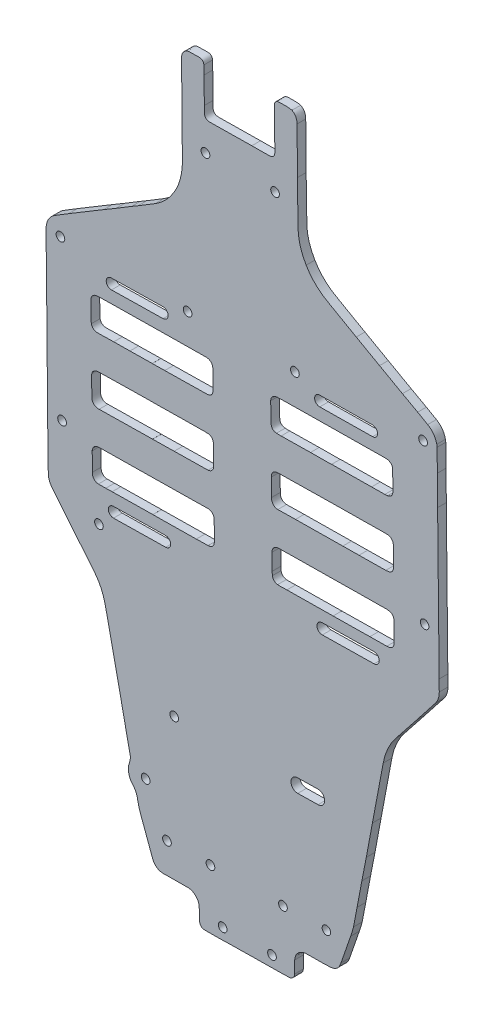
from build123d import *

# Parameters (mm, degrees)
MODEL_R             = 1.5
MODEL_R_2           = 1.468482627
MODEL_R_3           = 1.475701342
MODEL_R_4           = 1.507157975
BOSS_EXTRUDE1_DEPTH = 3


with BuildPart() as part:
    # Model → Boss-Extrude1 (new body)
    with BuildSketch(Plane.XY):
        with BuildLine():
            add(Edge.make_bspline(
                [(160.171925823, 234.723381136), (157.571158998, 236.19530425), (154.962787954, 237.654358503), (152.380608071, 239.158239547), (151.115466493, 239.89506832), (149.810857366, 240.560909295), (148.600443434, 241.399863038), (146.242257389, 243.034347797), (144.364707567, 245.080605145), (142.900254867, 247.544344253)],
                knots=[127, 127, 127, 127, 128, 128, 128, 129, 129, 129, 130, 130, 130, 130], degree=3))
            add(Edge.make_bspline(
                [(142.900254867, 247.544344253), (141.068991595, 250.625158939), (140.146608115, 253.947469964), (140.092159428, 257.51448809), (140.017305399, 262.418383717), (139.967568022, 267.322666494), (139.90706489, 272.226781506)],
                knots=[130, 130, 130, 130, 131, 131, 131, 132, 132, 132, 132], degree=3))
            add(Edge.make_bspline(
                [(139.90706489, 272.226781506), (139.912871372, 272.226853774), (139.918677854, 272.226926042), (139.924484337, 272.226995729)],
                knots=[0, 0, 0, 0, 1, 1, 1, 1], degree=3))
            add(Edge.make_bspline(
                [(139.924484337, 272.226995729), (139.888384961, 275.806403941), (139.852709189, 279.385814735), (139.815989904, 282.965216495), (139.798353489, 284.684448357), (139.787918352, 286.403843468), (139.753399745, 288.122746899)],
                knots=[1, 1, 1, 1, 2, 2, 2, 3, 3, 3, 3], degree=3))
            add(Edge.make_bspline(
                [(139.753399745, 288.122746899), (139.744979312, 288.541747576), (139.709458518, 288.975462529), (139.590559944, 289.373851348), (139.332853381, 290.237338778), (138.881704169, 290.98874955), (137.979312759, 291.313631516)],
                knots=[3, 3, 3, 3, 4, 4, 4, 5, 5, 5, 5], degree=3))
            add(Edge.make_bspline(
                [(137.979312759, 291.313631516), (137.587571507, 291.454658918), (137.157209915, 291.535657766), (136.74085827, 291.551576078), (135.83971701, 291.586027898), (134.936230427, 291.56772313), (134.033880344, 291.556125734), (133.753547097, 291.552522659), (133.4687815, 291.524875642), (133.194822985, 291.466839943), (132.495834097, 291.318765769), (132.113949401, 290.926184198), (132.019309938, 290.206882989)],
                knots=[5, 5, 5, 5, 6, 6, 6, 7, 7, 7, 8, 8, 8, 9, 9, 9, 9], degree=3))
            add(Edge.make_bspline(
                [(132.019309938, 290.206882989), (131.960904165, 289.762879529), (131.97053342, 289.308194604), (131.973085379, 288.858436806), (131.975482361, 288.436122771), (132.022450811, 288.014096517), (132.025942966, 287.591745703)],
                knots=[9, 9, 9, 9, 10, 10, 10, 11, 11, 11, 11], degree=3))
            add(Edge.make_bspline(
                [(132.025942966, 287.591745703), (132.03942599, 285.957408707), (132.04113074, 284.322978149), (132.051441895, 282.688609535)],
                knots=[11, 11, 11, 11, 12, 12, 12, 12], degree=3))
            add(Edge.make_bspline(
                [(132.051441895, 282.688609535), (132.064790605, 280.575224273), (132.082509675, 278.461867402), (132.097325504, 276.348489883), (132.099102577, 276.094855105), (132.106975423, 275.84037376), (132.090702808, 275.587655238)],
                knots=[12, 12, 12, 12, 13, 13, 13, 14, 14, 14, 14], degree=3))
            add(Edge.make_bspline(
                [(132.090702808, 275.587655238), (132.028422602, 274.620712332), (131.478604518, 274.038255694), (130.512517444, 273.908493385), (130.373234191, 273.889783723), (130.231502297, 273.884188117), (130.090762257, 273.882211072), (128.624573812, 273.861581147), (127.158375035, 273.840383401), (125.692124599, 273.825129697), (125.184542991, 273.819848973), (124.676641097, 273.84048406), (124.169162807, 273.832477801)],
                knots=[14, 14, 14, 14, 15, 15, 15, 16, 16, 16, 17, 17, 17, 18, 18, 18, 18], degree=3))
            add(Edge.make_bspline(
                [(124.169162807, 273.832477801), (121.970004121, 273.797802079), (119.770969417, 273.754936846), (117.571821063, 273.719832678), (117.09254864, 273.712182597), (116.61284228, 273.732451183), (116.133538861, 273.725709613), (114.01897711, 273.695973923), (111.904580667, 273.644490735), (109.789956925, 273.634226102), (108.519163842, 273.628054933), (107.846324788, 274.298890141), (107.810421717, 275.547292284), (107.790171351, 276.251441737), (107.805038839, 276.956529384), (107.797372629, 277.661121478)],
                knots=[18, 18, 18, 18, 19, 19, 19, 20, 20, 20, 21, 21, 21, 22, 22, 22, 23, 23, 23, 23], degree=3))
            add(Edge.make_bspline(
                [(107.797372629, 277.661121478), (107.764527777, 280.675856136), (107.732199515, 283.690601118), (107.693062584, 286.70525641)],
                knots=[23, 23, 23, 23, 24, 24, 24, 24], degree=3))
            add(Edge.make_bspline(
                [(107.693062584, 286.70525641), (107.68026146, 287.691583264), (107.666272177, 288.678568272), (107.618322205, 289.66357559)],
                knots=[24, 24, 24, 24, 25, 25, 25, 25], degree=3))
            add(Edge.make_bspline(
                [(107.618322205, 289.66357559), (107.57018626, 290.651982084), (106.946485337, 291.210315414), (105.97186418, 291.188498875), (104.929280317, 291.165162126), (103.88588024, 291.101826345), (102.844401882, 291.125252138), (101.553813034, 291.154280634), (100.013318146, 290.056831447), (99.967124583, 288.368394775)],
                knots=[25, 25, 25, 25, 26, 26, 26, 27, 27, 27, 28, 28, 28, 28], degree=3))
            add(Edge.make_bspline(
                [(99.967124583, 288.368394775), (99.933236216, 287.129297133), (99.947938394, 285.88867154), (99.953135299, 284.64877766)],
                knots=[28, 28, 28, 28, 29, 29, 29, 29], degree=3))
            add(Edge.make_bspline(
                [(99.953135299, 284.64877766), (99.956668782, 283.803899233), (99.98267397, 282.959130499), (99.99561974, 282.114266268)],
                knots=[29, 29, 29, 29, 30, 30, 30, 30], degree=3))
            add(Edge.make_bspline(
                [(99.99561974, 282.114266268), (100.001674186, 281.71991026), (99.997789422, 281.325405844), (100.00334794, 280.931038222)],
                knots=[30, 30, 30, 30, 31, 31, 31, 31], degree=3))
            add(Edge.make_bspline(
                [(100.00334794, 280.931038222), (100.015270859, 280.085872014), (100.036647393, 279.240796141), (100.042949803, 278.395600251)],
                knots=[31, 31, 31, 31, 32, 32, 32, 32], degree=3))
            add(Edge.make_bspline(
                [(100.042949803, 278.395600251), (100.056618799, 276.563853606), (100.064295341, 274.732059212), (100.072426483, 272.900272562), (100.078181306, 271.603942557), (100.072529801, 270.307509311), (100.086415766, 269.011277384)],
                knots=[32, 32, 32, 32, 33, 33, 33, 34, 34, 34, 34], degree=3))
            add(Edge.make_bspline(
                [(100.086415766, 269.011277384), (100.108432872, 266.954667649), (100.142310907, 264.898184382), (100.171591282, 262.841654658)],
                knots=[34, 34, 34, 34, 35, 35, 35, 35], degree=3))
            add(Edge.make_bspline(
                [(100.171591282, 262.841654658), (100.182016088, 262.109097438), (100.198485007, 261.376589258), (100.20378523, 260.644001067)],
                knots=[35, 35, 35, 35, 36, 36, 36, 36], degree=3))
            add(Edge.make_bspline(
                [(100.20378523, 260.644001067), (100.21440634, 259.17845302), (100.273070409, 257.710752421), (100.215615163, 256.247713105)],
                knots=[36, 36, 36, 36, 37, 37, 37, 37], degree=3))
            add(Edge.make_bspline(
                [(100.215615163, 256.247713105), (100.081673461, 252.837787486), (99.167700081, 249.642562274), (97.433979513, 246.689181835)],
                knots=[37, 37, 37, 37, 38, 38, 38, 38], degree=3))
            add(Edge.make_bspline(
                [(97.433979513, 246.689181835), (95.790269752, 243.889123064), (93.604284136, 241.612145049), (90.849149601, 239.89592005)],
                knots=[38, 38, 38, 38, 39, 39, 39, 39], degree=3))
            add(Edge.make_bspline(
                [(90.849149601, 239.89592005), (88.887168154, 238.673760214), (86.90010105, 237.491745238), (84.920849967, 236.297393087)],
                knots=[39, 39, 39, 39, 40, 40, 40, 40], degree=3))
            add(Edge.make_bspline(
                [(84.920849967, 236.297393087), (84.196739261, 235.860429946), (83.458205336, 235.447299751), (82.734456243, 235.009748143)],
                knots=[40, 40, 40, 40, 41, 41, 41, 41], degree=3))
            add(Edge.make_bspline(
                [(82.734456243, 235.009748143), (80.949526014, 233.930668572), (79.17419921, 232.835659074), (77.385730332, 231.762500314)],
                knots=[41, 41, 41, 41, 42, 42, 42, 42], degree=3))
            add(Edge.make_bspline(
                [(77.385730332, 231.762500314), (75.959489865, 230.906677161), (74.513949561, 230.08297196), (73.08714601, 229.228072804)],
                knots=[42, 42, 42, 42, 43, 43, 43, 43], degree=3))
            add(Edge.make_bspline(
                [(73.08714601, 229.228072804), (71.370545265, 228.199524032), (69.669411254, 227.145237537), (67.953079137, 226.116249995), (65.632268448, 224.724864376), (63.300929634, 223.35102955), (60.978832633, 221.961791321)],
                knots=[43, 43, 43, 43, 44, 44, 44, 45, 45, 45, 45], degree=3))
            add(Edge.make_bspline(
                [(60.978832633, 221.961791321), (59.503025264, 221.078867678), (58.037813176, 220.178295163), (56.56423748, 219.291634233), (54.316772374, 217.939319777), (53.209139378, 215.942245947), (53.21687791, 213.334698734), (53.222901361, 211.305517276), (53.273961211, 209.276511325), (53.294511199, 207.247329867), (53.323626265, 204.372561497), (53.337377916, 201.497638268), (53.36801176, 198.622890546), (53.414267314, 194.282372812), (53.474775612, 189.941999615), (53.519393573, 185.601471557)],
                knots=[45, 45, 45, 45, 46, 46, 46, 47, 47, 47, 48, 48, 48, 49, 49, 49, 50, 50, 50, 50], degree=3))
            add(Edge.make_bspline(
                [(53.519393573, 185.601471557), (53.571543429, 180.528714066), (53.61380057, 175.45586366), (53.658981614, 170.383033902), (53.682078396, 167.790089982), (53.700939132, 165.197104765), (53.724149563, 162.604160845)],
                knots=[50, 50, 50, 50, 51, 51, 51, 52, 52, 52, 52], degree=3))
            add(Edge.make_bspline(
                [(53.724149563, 162.604160845), (53.741047253, 160.716046471), (53.762279141, 158.827973393), (53.780948739, 156.939879667), (53.79822354, 155.192842701), (53.813519798, 153.445805735), (53.831750293, 151.698779094), (53.85439764, 149.528871243), (53.873418519, 147.358901448), (53.905013222, 145.189117485), (53.926756535, 143.695937262), (53.971250514, 142.203097732), (53.997896276, 140.709979454), (54.016049282, 139.692807725), (54.355945466, 138.776129776), (54.872619074, 137.920662801)],
                knots=[52, 52, 52, 52, 53, 53, 53, 54, 54, 54, 55, 55, 55, 56, 56, 56, 57, 57, 57, 57], degree=3))
            add(Edge.make_bspline(
                [(54.872619074, 137.920662801), (55.104800878, 137.536228153), (55.372694615, 137.169199763), (55.657238078, 136.821074611), (58.493864836, 133.350642631), (61.335967457, 129.884670617), (64.17969734, 126.420040724)],
                knots=[57, 57, 57, 57, 58, 58, 58, 59, 59, 59, 59], degree=3))
            add(Edge.make_bspline(
                [(64.17969734, 126.420040724), (65.163136705, 125.221868693), (66.158643634, 124.033597376), (67.142873383, 122.836065433)],
                knots=[59, 59, 59, 59, 60, 60, 60, 60], degree=3))
            add(Edge.make_bspline(
                [(67.142873383, 122.836065433), (68.127211616, 121.638440575), (69.127791469, 120.453101272), (70.079641297, 119.230058735)],
                knots=[60, 60, 60, 60, 61, 61, 61, 61], degree=3))
            add(Edge.make_bspline(
                [(70.079641297, 119.230058735), (71.912717803, 116.874680292), (73.051351422, 114.194839295), (73.678751136, 111.29034814), (74.255700577, 108.619427077), (74.820969896, 105.945966309), (75.392154182, 103.273785718), (76.122159191, 99.858607766), (76.856126452, 96.444235086), (77.582458499, 93.028251862)],
                knots=[61, 61, 61, 61, 62, 62, 62, 63, 63, 63, 64, 64, 64, 64], degree=3))
            add(Edge.make_bspline(
                [(77.582458499, 93.028251862), (78.25616026, 89.85981742), (78.926653991, 86.690680946), (79.590075591, 83.520078465)],
                knots=[64, 64, 64, 64, 65, 65, 65, 65], degree=3))
            add(Edge.make_bspline(
                [(79.590075591, 83.520078465), (80.207381118, 80.569831359), (80.811074472, 77.61673483), (81.425760882, 74.665930228)],
                knots=[65, 65, 65, 65, 66, 66, 66, 66], degree=3))
            add(Edge.make_bspline(
                [(81.425760882, 74.665930228), (81.666983028, 73.507970163), (81.907001517, 72.349370011), (82.175525495, 71.197583696)],
                knots=[66, 66, 66, 66, 67, 67, 67, 67], degree=3))
            add(Edge.make_bspline(
                [(82.175525495, 71.197583696), (82.360888661, 70.402470802), (82.291381348, 69.63141282), (82.070905495, 68.860932982)],
                knots=[67, 67, 67, 67, 68, 68, 68, 68], degree=3))
            add(Edge.make_bspline(
                [(82.070905495, 68.860932982), (81.962374902, 68.48162936), (81.838227764, 68.106001081), (81.749529097, 67.722154902), (81.680238752, 67.422284107), (81.626446136, 67.113452084), (81.614445728, 66.806705508)],
                knots=[68, 68, 68, 68, 69, 69, 69, 70, 70, 70, 70], degree=3))
            add(Edge.make_bspline(
                [(81.614445728, 66.806705508), (81.548549386, 65.12176738), (82.077714164, 63.644073152), (83.21962297, 62.399391519)],
                knots=[70, 70, 70, 70, 71, 71, 71, 71], degree=3))
            add(Edge.make_bspline(
                [(83.21962297, 62.399391519), (83.963839395, 61.588173191), (84.437703112, 60.647161583), (84.661355999, 59.574808095)],
                knots=[71, 71, 71, 71, 72, 72, 72, 72], degree=3))
            add(Edge.make_bspline(
                [(84.661355999, 59.574808095), (84.730388048, 59.24377948), (84.799399434, 58.912750865), (84.865476583, 58.581123458), (85.119107243, 57.308154075), (85.443676174, 56.055151301), (85.906696646, 54.840285369)],
                knots=[72, 72, 72, 72, 73, 73, 73, 74, 74, 74, 74], degree=3))
            add(Edge.make_bspline(
                [(85.906696646, 54.840285369), (86.277965398, 53.866133733), (86.651155869, 52.892684129), (87.013430773, 51.915187518)],
                knots=[74, 74, 74, 74, 75, 75, 75, 75], degree=3))
            add(Edge.make_bspline(
                [(87.013430773, 51.915187518), (87.493106138, 50.620950703), (87.961447497, 49.322563642), (88.437465397, 48.026964059)],
                knots=[75, 75, 75, 75, 76, 76, 76, 76], degree=3))
            add(Edge.make_bspline(
                [(88.437465397, 48.026964059), (88.952423923, 46.625419627), (89.473560878, 45.226105179), (89.986639013, 43.823858715)],
                knots=[76, 76, 76, 76, 77, 77, 77, 77], degree=3))
            add(Edge.make_bspline(
                [(89.986639013, 43.823858715), (90.577484751, 42.209103113), (92.069657721, 41.201109417), (93.772517146, 41.270734448)],
                knots=[77, 77, 77, 77, 78, 78, 78, 78], degree=3))
            add(Edge.make_bspline(
                [(93.772517146, 41.270734448), (94.110636257, 41.284547955), (94.449158309, 41.292683264), (94.787546047, 41.294789359), (97.184600396, 41.30969721), (99.581654745, 41.326422084), (101.978729757, 41.331129826), (102.314286577, 41.331790562), (102.661353043, 41.313661624), (102.983664471, 41.229748183)],
                knots=[78, 78, 78, 78, 79, 79, 79, 80, 80, 80, 81, 81, 81, 81], degree=3))
            add(Edge.make_bspline(
                [(102.983664471, 41.229748183), (104.672172999, 40.790214368), (105.888000805, 39.31580317), (106.024391148, 37.574454727), (106.039775227, 37.378009726), (106.036572363, 37.180098719), (106.041572964, 36.982869095)],
                knots=[81, 81, 81, 81, 82, 82, 82, 83, 83, 83, 83], degree=3))
            add(Edge.make_bspline(
                [(106.041572964, 36.982869095), (106.072330789, 35.771410082), (106.093170068, 34.559538108), (106.141099377, 33.348760479)],
                knots=[83, 83, 83, 83, 84, 84, 84, 84], degree=3))
            add(Edge.make_bspline(
                [(106.141099377, 33.348760479), (106.151937455, 33.075257171), (106.214827238, 32.786618884), (106.326514202, 32.537521503), (106.652131812, 31.811290313), (107.266854383, 31.52261073), (108.034115932, 31.522879154)],
                knots=[84, 84, 84, 84, 85, 85, 85, 86, 86, 86, 86], degree=3))
            add(Edge.make_bspline(
                [(108.034115932, 31.522879154), (109.359708983, 31.523312762), (110.685508671, 31.518563724), (112.010833095, 31.54009958)],
                knots=[86, 86, 86, 86, 87, 87, 87, 87], degree=3))
            add(Edge.make_bspline(
                [(112.010833095, 31.54009958), (113.786862462, 31.568944825), (115.562313248, 31.63697996), (117.338373611, 31.658825536)],
                knots=[87, 87, 87, 87, 88, 88, 88, 88], degree=3))
            add(Edge.make_bspline(
                [(117.338373611, 31.658825536), (119.96051697, 31.691057053), (122.583724506, 31.645218509), (125.20435942, 31.780504156)],
                knots=[88, 88, 88, 88, 89, 89, 89, 89], degree=3))
            add(Edge.make_bspline(
                [(125.20435942, 31.780504156), (125.654837063, 31.803774444), (126.106172248, 31.817319527), (126.557238805, 31.821056813), (128.954003863, 31.840920182), (131.350903234, 31.847857907), (133.747533979, 31.877012873)],
                knots=[89, 89, 89, 89, 90, 90, 90, 91, 91, 91, 91], degree=3))
            add(Edge.make_bspline(
                [(133.747533979, 31.877012873), (134.81794143, 31.890021108), (135.887718641, 31.948702703), (136.958022775, 31.977878316)],
                knots=[91, 91, 91, 91, 92, 92, 92, 92], degree=3))
            add(Edge.make_bspline(
                [(136.958022775, 31.977878316), (137.331631685, 31.988057776), (137.679225074, 32.050559249), (138.00311727, 32.25749343)],
                knots=[92, 92, 92, 92, 93, 93, 93, 93], degree=3))
            add(Edge.make_bspline(
                [(138.00311727, 32.25749343), (138.602776049, 32.640575634), (138.88494836, 33.199475493), (138.911935072, 33.885463747)],
                knots=[93, 93, 93, 93, 94, 94, 94, 94], degree=3))
            add(Edge.make_bspline(
                [(138.911935072, 33.885463747), (138.941814692, 34.645289221), (138.937000065, 35.406560055), (138.94112246, 36.167232097), (138.944635279, 36.815289988), (138.899495561, 37.46632119), (138.946660316, 38.110868923)],
                knots=[94, 94, 94, 94, 95, 95, 95, 96, 96, 96, 96], degree=3))
            add(Edge.make_bspline(
                [(138.946660316, 38.110868923), (139.034966373, 39.31776473), (139.529209602, 40.346716138), (140.504874273, 41.088123603)],
                knots=[96, 96, 96, 96, 97, 97, 97, 97], degree=3))
            add(Edge.make_bspline(
                [(140.504874273, 41.088123603), (141.262485903, 41.663872224), (142.126463609, 41.977060974), (143.098760107, 41.975202655)],
                knots=[97, 97, 97, 97, 98, 98, 98, 98], degree=3))
            add(Edge.make_bspline(
                [(143.098760107, 41.975202655), (144.790967427, 41.971981568), (146.483371051, 41.979931045), (148.175413061, 42.003614292)],
                knots=[98, 98, 98, 98, 99, 99, 99, 99], degree=3))
            add(Edge.make_bspline(
                [(148.175413061, 42.003614292), (149.246698717, 42.018584087), (150.323263933, 42.012843945), (151.387121012, 42.11944953)],
                knots=[99, 99, 99, 99, 100, 100, 100, 100], degree=3))
            add(Edge.make_bspline(
                [(151.387121012, 42.11944953), (153.014671808, 42.282486078), (154.149849433, 43.153975896), (154.727098497, 44.7075102), (154.786000197, 44.866024838), (154.847474521, 45.023672261), (154.902832408, 45.183425778)],
                knots=[100, 100, 100, 100, 101, 101, 101, 102, 102, 102, 102], degree=3))
            add(Edge.make_bspline(
                [(154.902832408, 45.183425778), (156.019206122, 48.404450657), (157.144661506, 51.622419633), (158.245051897, 54.848895582)],
                knots=[102, 102, 102, 102, 103, 103, 103, 103], degree=3))
            add(Edge.make_bspline(
                [(158.245051897, 54.848895582), (158.608638942, 55.914951432), (158.982671457, 56.986953905), (159.219394095, 58.08474572)],
                knots=[103, 103, 103, 103, 104, 104, 104, 104], degree=3))
            add(Edge.make_bspline(
                [(159.219394095, 58.08474572), (159.682507554, 60.232487951), (160.053926118, 62.400010959), (160.460462535, 64.559873561)],
                knots=[104, 104, 104, 104, 105, 105, 105, 105], degree=3))
            add(Edge.make_bspline(
                [(160.460462535, 64.559873561), (161.007800982, 67.467833579), (161.543051201, 70.378085523), (162.101093413, 73.283980741)],
                knots=[105, 105, 105, 105, 106, 106, 106, 106], degree=3))
            add(Edge.make_bspline(
                [(162.101093413, 73.283980741), (162.600698857, 75.885607143), (163.139306917, 78.479758971), (163.633508819, 81.082376475)],
                knots=[106, 106, 106, 106, 107, 107, 107, 107], degree=3))
            add(Edge.make_bspline(
                [(163.633508819, 81.082376475), (164.348439703, 84.847455308), (165.035164722, 88.617861322), (165.74079697, 92.384715881)],
                knots=[107, 107, 107, 107, 108, 108, 108, 108], degree=3))
            add(Edge.make_bspline(
                [(165.74079697, 92.384715881), (166.373786197, 95.76382179), (167.017189898, 99.140945492), (167.653867585, 102.519370018), (168.259301852, 105.731991164), (168.868507232, 108.94388963), (169.464074611, 112.158348447)],
                knots=[108, 108, 108, 108, 109, 109, 109, 110, 110, 110, 110], degree=3))
            add(Edge.make_bspline(
                [(169.464074611, 112.158348447), (170.129578073, 115.750231919), (171.601087405, 118.964897216), (173.888655467, 121.818346533)],
                knots=[110, 110, 110, 110, 111, 111, 111, 111], degree=3))
            add(Edge.make_bspline(
                [(173.888655467, 121.818346533), (176.216393641, 124.721929176), (178.519521423, 127.645323568), (180.822525222, 130.568635368)],
                knots=[111, 111, 111, 111, 112, 112, 112, 112], degree=3))
            add(Edge.make_bspline(
                [(180.822525222, 130.568635368), (183.020371767, 133.358509516), (185.198195247, 136.164158731), (187.396971656, 138.953299875)],
                knots=[112, 112, 112, 112, 113, 113, 113, 113], degree=3))
            add(Edge.make_bspline(
                [(187.396971656, 138.953299875), (188.343738229, 140.154280033), (188.787779149, 141.519184602), (188.79420554, 143.030349226)],
                knots=[113, 113, 113, 113, 114, 114, 114, 114], degree=3))
            add(Edge.make_bspline(
                [(188.79420554, 143.030349226), (188.799743395, 144.326743756), (188.770834966, 145.623282822), (188.755564537, 146.91974962)],
                knots=[114, 114, 114, 114, 115, 115, 115, 115], degree=3))
            add(Edge.make_bspline(
                [(188.755564537, 146.91974962), (188.704153405, 151.288266032), (188.647844991, 155.656741147), (188.601331142, 160.025309179), (188.551221819, 164.731668043), (188.510039189, 169.438109499), (188.464868476, 174.144519983), (188.440258083, 176.708979998), (188.41701149, 179.273450337), (188.390500042, 181.837889704), (188.335431446, 187.164462642), (188.274763005, 192.490983959), (188.223889127, 197.817598193)],
                knots=[115, 115, 115, 115, 116, 116, 116, 117, 117, 117, 118, 118, 118, 119, 119, 119, 119], degree=3))
            add(Edge.make_bspline(
                [(188.223889127, 197.817598193), (188.191343897, 201.226870819), (188.178387796, 204.636349925), (188.145078011, 208.045612227)],
                knots=[119, 119, 119, 119, 120, 120, 120, 120], degree=3))
            add(Edge.make_bspline(
                [(188.145078011, 208.045612227), (188.120033682, 210.609855438), (188.07947096, 213.173974761), (188.03721382, 215.73800633)],
                knots=[120, 120, 120, 120, 121, 121, 121, 121], degree=3))
            add(Edge.make_bspline(
                [(188.03721382, 215.73800633), (188.032626493, 216.017213646), (187.994605398, 216.30086028), (187.932180548, 216.573320865)],
                knots=[121, 121, 121, 121, 122, 122, 122, 122], degree=3))
            add(Edge.make_bspline(
                [(187.932180548, 216.573320865), (187.500951083, 218.454657535), (186.465558166, 219.911265001), (184.803395776, 220.898775888)],
                knots=[122, 122, 122, 122, 123, 123, 123, 123], degree=3))
            add(Edge.make_bspline(
                [(184.803395776, 220.898775888), (183.664478032, 221.575431249), (182.50921535, 222.225177113), (181.351906968, 222.870230721)],
                knots=[123, 123, 123, 123, 124, 124, 124, 124], degree=3))
            add(Edge.make_bspline(
                [(181.351906968, 222.870230721), (179.603907826, 223.844495921), (177.844068419, 224.797467879), (176.096027949, 225.771624677)],
                knots=[124, 124, 124, 124, 125, 125, 125, 125], degree=3))
            add(Edge.make_bspline(
                [(176.096027949, 225.771624677), (173.46110413, 227.240016985), (170.830333702, 228.715847731), (168.200968401, 230.194145913)],
                knots=[125, 125, 125, 125, 126, 126, 126, 126], degree=3))
            add(Edge.make_bspline(
                [(168.200968401, 230.194145913), (165.522454637, 231.700065947), (162.846141551, 233.209878127), (160.171925823, 234.723381136)],
                knots=[126, 126, 126, 126, 127, 127, 127, 127], degree=3))
        make_face()
        with Locations((94.90607237, 51.702259327)):
            Circle(MODEL_R, mode=Mode.SUBTRACT)
        with Locations((114.116887182, 35.46431498)):
            Circle(MODEL_R, mode=Mode.SUBTRACT)
        with Locations((109.904670104, 51.907359304)):
            Circle(MODEL_R, mode=Mode.SUBTRACT)
        with Locations((87.564214873, 66.516701925)):
            Circle(MODEL_R, mode=Mode.SUBTRACT)
        with Locations((97.415715765, 90.06520219)):
            Circle(MODEL_R, mode=Mode.SUBTRACT)
        with Locations((58.744653163, 159.046885118)):
            Circle(MODEL_R, mode=Mode.SUBTRACT)
        with Locations((71.447204711, 134.48992024)):
            Circle(MODEL_R, mode=Mode.SUBTRACT)
        with BuildLine():
            ThreePointArc((76.481793422, 138.805876994), (74.703285684, 140.526897105), (76.424305795, 142.305404844))
            Line((76.424305795, 142.305404844), (94.421877595, 142.601055494))
            ThreePointArc((94.421877595, 142.601055494), (96.200385334, 140.880035382), (94.479365222, 139.101527644))
            Line((94.479365222, 139.101527644), (76.481793422, 138.805876994))
        make_face(mode=Mode.SUBTRACT)
        with BuildLine():
            add(Edge.make_bspline(
                [(76.005549115, 146.444794174), (78.06418473, 146.466681046), (80.12307864, 146.469354961), (82.181564443, 146.500058526), (84.804121075, 146.539176147), (87.42638325, 146.598384266), (90.048764241, 146.648920227)],
                knots=[22, 22, 22, 22, 23, 23, 23, 24, 24, 24, 24], degree=3))
            add(Edge.make_bspline(
                [(73.806168295, 146.392740585), (74.539396831, 146.401423066), (75.272320579, 146.436989233), (76.005549115, 146.444794174)],
                knots=[21, 21, 21, 21, 22, 22, 22, 22], degree=3))
            add(Edge.make_bspline(
                [(71.268198266, 146.384863376), (72.1140178, 146.398284571), (72.960266105, 146.382715985), (73.806168295, 146.392740585)],
                knots=[20, 20, 20, 20, 21, 21, 21, 21], degree=3))
            add(Edge.make_bspline(
                [(69.215839231, 148.87326651), (69.218825127, 148.648007237), (69.220571204, 148.420889644), (69.249706934, 148.198149425), (69.35453357, 147.396759542), (70.073819317, 146.365929167), (71.268198266, 146.384863376)],
                knots=[18, 18, 18, 18, 19, 19, 19, 20, 20, 20, 20], degree=3))
            add(Edge.make_bspline(
                [(69.137870158, 155.214502445), (69.158120524, 153.10069519), (69.187855499, 150.986991174), (69.215839231, 148.87326651)],
                knots=[17, 17, 17, 17, 18, 18, 18, 18], degree=3))
            add(Edge.make_bspline(
                [(71.039059182, 157.350640504), (69.957741329, 157.228435361), (69.127605496, 156.285431222), (69.137870158, 155.214502445)],
                knots=[16, 16, 16, 16, 17, 17, 17, 17], degree=3))
            add(Edge.make_bspline(
                [(72.812918868, 157.448811385), (72.22107611, 157.440139228), (71.626650397, 157.417034124), (71.039059182, 157.350640504)],
                knots=[15, 15, 15, 15, 16, 16, 16, 16], degree=3))
            add(Edge.make_bspline(
                [(80.765733284, 157.553228282), (80.258094852, 157.546486713), (79.75063206, 157.52625168), (79.242988461, 157.520470242), (77.09963193, 157.496064315), (74.956166915, 157.480196333), (72.812918868, 157.448811385)],
                knots=[13, 13, 13, 13, 14, 14, 14, 15, 15, 15, 15], degree=3))
            add(Edge.make_bspline(
                [(91.255964978, 157.691353028), (87.759315788, 157.638649027), (84.262470294, 157.599634646), (80.765733284, 157.553228282)],
                knots=[12, 12, 12, 12, 13, 13, 13, 13], degree=3))
            add(Edge.make_bspline(
                [(103.437789247, 157.853388149), (101.633130409, 157.832864044), (99.82806863, 157.844974092), (98.023492446, 157.819938401), (95.767488091, 157.788636044), (93.511948668, 157.725339624), (91.255964978, 157.691353028)],
                knots=[10, 10, 10, 10, 11, 11, 11, 12, 12, 12, 12], degree=3))
            add(Edge.make_bspline(
                [(108.258760674, 157.942484236), (106.651770198, 157.912369139), (105.044914036, 157.871671946), (103.437789247, 157.853388149)],
                knots=[9, 9, 9, 9, 10, 10, 10, 10], degree=3))
            add(Edge.make_bspline(
                [(108.935577478, 157.947460402), (108.710405813, 157.956628111), (108.484345612, 157.946717075), (108.258760674, 157.942484236)],
                knots=[8, 8, 8, 8, 9, 9, 9, 9], degree=3))
            add(Edge.make_bspline(
                [(111.241711819, 152.494273975), (111.22944795, 153.593284022), (111.226348404, 154.693584567), (111.168004622, 155.790591759), (111.096591088, 157.133382328), (110.286369836, 157.892371559), (108.935577478, 157.947460402)],
                knots=[6, 6, 6, 6, 7, 7, 7, 8, 8, 8, 8], degree=3))
            add(Edge.make_bspline(
                [(111.24768361, 149.196706988), (111.251981647, 150.295882219), (111.25398602, 151.395201985), (111.241711819, 152.494273975)],
                knots=[5, 5, 5, 5, 6, 6, 6, 6], degree=3))
            add(Edge.make_bspline(
                [(109.0828059, 146.908341604), (110.468840093, 146.970956642), (111.242290401, 147.812692702), (111.24768361, 149.196706988)],
                knots=[4, 4, 4, 4, 5, 5, 5, 5], degree=3))
            add(Edge.make_bspline(
                [(105.023041575, 146.817283958), (106.376530538, 146.835185767), (107.730918369, 146.847275167), (109.0828059, 146.908341604)],
                knots=[3, 3, 3, 3, 4, 4, 4, 4], degree=3))
            add(Edge.make_bspline(
                [(90.049167182, 146.629387226), (92.361046014, 146.662331098), (94.672893851, 146.698816101), (96.984834674, 146.727310331), (99.664195647, 146.760336795), (102.343711598, 146.781862327), (105.023041575, 146.817283958)],
                knots=[1, 1, 1, 1, 2, 2, 2, 3, 3, 3, 3], degree=3))
            add(Edge.make_bspline(
                [(90.048764241, 146.648920227), (90.048898555, 146.642405786), (90.049032868, 146.635901668), (90.049167182, 146.629387226)],
                knots=[0, 0, 0, 0, 1, 1, 1, 1], degree=3))
        make_face(mode=Mode.SUBTRACT)
        with Locations((131.115409537, 35.688452762)):
            Circle(MODEL_R, mode=Mode.SUBTRACT)
        with Locations((134.902332995, 52.249192599)):
            Circle(MODEL_R, mode=Mode.SUBTRACT)
        with Locations((149.891487016, 52.454163437)):
            Circle(MODEL_R_2, mode=Mode.SUBTRACT)
        with BuildLine():
            ThreePointArc((140.004890612, 88.378228036), (137.650518158, 90.650947498), (139.92323762, 93.005319952))
            Line((139.92323762, 93.005319952), (146.922147951, 93.128827757))
            ThreePointArc((146.922147951, 93.128827757), (149.276520405, 90.856108295), (147.003800943, 88.501735841))
            Line((147.003800943, 88.501735841), (140.004890612, 88.378228036))
        make_face(mode=Mode.SUBTRACT)
        with BuildLine():
            add(Edge.make_bspline(
                [(136.273622416, 147.256157037), (141.575694998, 147.318834018), (146.877839903, 147.376741313), (152.179953812, 147.436166236)],
                knots=[25, 25, 25, 25, 26, 26, 26, 26], degree=3))
            add(Edge.make_bspline(
                [(133.062307074, 147.241290483), (133.39488833, 147.192385713), (133.737181496, 147.192241177), (134.074629039, 147.197237991), (134.807754257, 147.208088511), (135.540507529, 147.247495205), (136.273622416, 147.256157037)],
                knots=[23, 23, 23, 23, 24, 24, 24, 25, 25, 25, 25], degree=3))
            add(Edge.make_bspline(
                [(131.267587445, 149.009594881), (131.414681554, 148.060675091), (132.109155437, 147.38140776), (133.062307074, 147.241290483)],
                knots=[22, 22, 22, 22, 23, 23, 23, 23], degree=3))
            add(Edge.make_bspline(
                [(131.188662679, 150.273799191), (131.193167353, 149.851847141), (131.20314789, 149.425249293), (131.267587445, 149.009594881)],
                knots=[21, 21, 21, 21, 22, 22, 22, 22], degree=3))
            add(Edge.make_bspline(
                [(131.145537667, 155.937543521), (131.186534325, 155.604130063), (131.1575949, 155.2620238), (131.159537281, 154.923912923), (131.168432978, 153.37386813), (131.172131769, 151.823761392), (131.188662679, 150.273799191)],
                knots=[19, 19, 19, 19, 20, 20, 20, 21, 21, 21, 21], degree=3))
            add(Edge.make_bspline(
                [(134.581125805, 158.286015211), (134.101905041, 158.275484735), (133.622487972, 158.261278916), (133.143949108, 158.234694625), (132.132680989, 158.178521762), (130.991810531, 157.18797562), (131.145537667, 155.937543521)],
                knots=[17, 17, 17, 17, 18, 18, 18, 19, 19, 19, 19], degree=3))
            add(Edge.make_bspline(
                [(142.447204601, 158.38764463), (140.557886837, 158.3707236), (138.66866206, 158.344861989), (136.779406287, 158.321312954), (136.046611687, 158.312176217), (135.313796423, 158.302120645), (134.581125805, 158.286015211)],
                knots=[15, 15, 15, 15, 16, 16, 16, 17, 17, 17, 17], degree=3))
            add(Edge.make_bspline(
                [(153.948843893, 158.521299085), (151.862529335, 158.491245932), (149.776411081, 158.44569646), (147.690034532, 158.420733037), (145.942541649, 158.399826945), (144.194780139, 158.403306132), (142.447204601, 158.38764463)],
                knots=[13, 13, 13, 13, 14, 14, 14, 15, 15, 15, 15], degree=3))
            add(Edge.make_bspline(
                [(161.983310676, 158.625003627), (159.305086203, 158.596550693), (156.626944384, 158.559848887), (153.948843893, 158.521299085)],
                knots=[12, 12, 12, 12, 13, 13, 13, 13], degree=3))
            add(Edge.make_bspline(
                [(171.773484138, 158.529898974), (171.344465683, 158.647035035), (170.887117379, 158.704901034), (170.441805645, 158.70905128), (169.427024707, 158.718508061), (168.411871824, 158.669789122), (167.39671894, 158.660115538), (165.592297734, 158.642926084), (163.787700887, 158.644185612), (161.983310676, 158.625003627)],
                knots=[9, 9, 9, 9, 10, 10, 10, 11, 11, 11, 12, 12, 12, 12], degree=3))
            add(Edge.make_bspline(
                [(173.146520902, 156.881043212), (173.021877837, 157.705321395), (172.595710964, 158.305424324), (171.773484138, 158.529898974)],
                knots=[8, 8, 8, 8, 9, 9, 9, 9], degree=3))
            add(Edge.make_bspline(
                [(173.251595502, 150.288170193), (173.2265925, 152.317083228), (173.199130525, 154.345965291), (173.171048641, 156.374837029), (173.16871365, 156.543768579), (173.171647886, 156.714837197), (173.146520902, 156.881043212)],
                knots=[6, 6, 6, 6, 7, 7, 7, 8, 8, 8, 8], degree=3))
            add(Edge.make_bspline(
                [(173.232936237, 149.612237512), (173.254240448, 149.836154667), (173.25436443, 150.062879948), (173.251595502, 150.288170193)],
                knots=[5, 5, 5, 5, 6, 6, 6, 6], degree=3))
            add(Edge.make_bspline(
                [(170.708573214, 147.664842752), (171.165632226, 147.668425179), (171.605592078, 147.720860756), (172.027140628, 147.911224922), (172.764501892, 148.244204772), (173.157358981, 148.817021379), (173.232936237, 149.612237512)],
                knots=[3, 3, 3, 3, 4, 4, 4, 5, 5, 5, 5], degree=3))
            add(Edge.make_bspline(
                [(164.87049619, 147.602279335), (166.816463317, 147.627882846), (168.762502768, 147.649563238), (170.708573214, 147.664842752)],
                knots=[2, 2, 2, 2, 3, 3, 3, 3], degree=3))
            add(Edge.make_bspline(
                [(152.180077794, 147.429207862), (156.410213815, 147.487135805), (160.640329173, 147.546632995), (164.87049619, 147.602279335)],
                knots=[1, 1, 1, 1, 2, 2, 2, 2], degree=3))
            add(Edge.make_bspline(
                [(152.179953812, 147.436166236), (152.17999514, 147.433843336), (152.180036467, 147.431530761), (152.180077794, 147.429207862)],
                knots=[0, 0, 0, 0, 1, 1, 1, 1], degree=3))
        make_face(mode=Mode.SUBTRACT)
        with BuildLine():
            ThreePointArc((148.473148673, 139.923462551), (146.62855584, 141.708431655), (148.413524944, 143.553024487))
            Line((148.413524944, 143.553024487), (166.264894834, 143.846273442))
            ThreePointArc((166.264894834, 143.846273442), (168.109487667, 142.061304338), (166.324518563, 140.216711506))
            Line((166.324518563, 140.216711506), (148.473148673, 139.923462551))
        make_face(mode=Mode.SUBTRACT)
        with Locations((183.733302897, 160.731354692)):
            Circle(MODEL_R_3, mode=Mode.SUBTRACT)
        with Locations((58.1736891, 213.700203487)):
            Circle(MODEL_R, mode=Mode.SUBTRACT)
        with BuildLine():
            ThreePointArc((75.769468953, 206.588882009), (73.968593178, 208.324278523), (75.703989692, 210.125154298))
            Line((75.703989692, 210.125154298), (93.507214018, 210.454807072))
            ThreePointArc((93.507214018, 210.454807072), (95.308089794, 208.719410558), (93.572693279, 206.918534783))
            Line((93.572693279, 206.918534783), (75.769468953, 206.588882009))
        make_face(mode=Mode.SUBTRACT)
        with BuildLine():
            add(Edge.make_bspline(
                [(71.513945748, 168.826743091), (72.610260236, 168.895490582), (73.711446177, 168.892176579), (74.810648409, 168.908426549), (79.856440219, 168.983027746), (84.902299186, 169.053210272), (89.948132323, 169.124982694)],
                knots=[19, 19, 19, 19, 20, 20, 20, 21, 21, 21, 21], degree=3))
            add(Edge.make_bspline(
                [(79.472690629, 180.02074248), (76.851905904, 179.97297335), (74.231136677, 179.924450567), (71.610434607, 179.872603458), (71.329078509, 179.867038824), (71.044204428, 179.860978638), (70.767802438, 179.814530979), (69.612663738, 179.620408878), (68.899081156, 178.735074582), (68.919574319, 177.557271796), (68.955833838, 175.473331862), (69.043488991, 173.388163372), (69.00165029, 171.305679121), (68.969983264, 169.729566237), (69.998588176, 168.731690057), (71.513945748, 168.826743091)],
                knots=[14, 14, 14, 14, 15, 15, 15, 16, 16, 16, 17, 17, 17, 18, 18, 18, 19, 19, 19, 19], degree=3))
            add(Edge.make_bspline(
                [(86.997034177, 180.151950148), (84.488778459, 180.118582992), (81.980770705, 180.066477783), (79.472690629, 180.02074248)],
                knots=[13, 13, 13, 13, 14, 14, 14, 14], degree=3))
            add(Edge.make_bspline(
                [(92.746288552, 180.192162113), (90.829984077, 180.169222194), (88.913286993, 180.177450419), (86.997034177, 180.151950148)],
                knots=[12, 12, 12, 12, 13, 13, 13, 13], degree=3))
            add(Edge.make_bspline(
                [(99.341853224, 180.297404931), (97.143242124, 180.269199773), (94.944920315, 180.218488304), (92.746288552, 180.192162113)],
                knots=[11, 11, 11, 11, 12, 12, 12, 12], degree=3))
            add(Edge.make_bspline(
                [(109.065489771, 180.345917389), (108.644116862, 180.375846654), (108.22039863, 180.38859679), (107.797951211, 180.384859503), (104.979213999, 180.359906404), (102.160466454, 180.333549242), (99.341853224, 180.297404931)],
                knots=[9, 9, 9, 9, 10, 10, 10, 11, 11, 11, 11], degree=3))
            add(Edge.make_bspline(
                [(111.034734487, 172.052176316), (111.025198218, 172.840681852), (111.011818513, 173.629146092), (110.995463243, 174.417538064), (110.9680116, 175.740991788), (110.930899706, 177.06425968), (110.909502508, 178.387806321), (110.889892716, 179.600968793), (109.935759556, 180.284086976), (109.065489771, 180.345917389)],
                knots=[6, 6, 6, 6, 7, 7, 7, 8, 8, 8, 9, 9, 9, 9], degree=3))
            add(Edge.make_bspline(
                [(111.014618435, 171.292805098), (111.045675884, 171.542976174), (111.037803037, 171.799000957), (111.034734487, 172.052176316)],
                knots=[5, 5, 5, 5, 6, 6, 6, 6], degree=3))
            add(Edge.make_bspline(
                [(109.058980725, 169.414002968), (110.143687415, 169.502149248), (110.88071806, 170.214391424), (111.014618435, 171.292805098)],
                knots=[4, 4, 4, 4, 5, 5, 5, 5], degree=3))
            add(Edge.make_bspline(
                [(97.389676673, 169.23394215), (100.744253018, 169.279274817), (104.099077327, 169.307015395), (107.453736327, 169.347660968), (107.989089864, 169.354144438), (108.525579902, 169.370662832), (109.058980725, 169.414002968)],
                knots=[2, 2, 2, 2, 3, 3, 3, 4, 4, 4, 4], degree=3))
            add(Edge.make_bspline(
                [(89.948504269, 169.101908562), (92.428884738, 169.146652762), (94.909141226, 169.20040981), (97.389676673, 169.23394215)],
                knots=[1, 1, 1, 1, 2, 2, 2, 2], degree=3))
            add(Edge.make_bspline(
                [(89.948132323, 169.124982694), (89.948256305, 169.117291317), (89.948380287, 169.109599939), (89.948504269, 169.101908562)],
                knots=[0, 0, 0, 0, 1, 1, 1, 1], degree=3))
        make_face(mode=Mode.SUBTRACT)
        with BuildLine():
            add(Edge.make_bspline(
                [(82.141947083, 191.539214747), (84.706697187, 191.574367954), (87.271312978, 191.61915345), (89.835990759, 191.659819671)],
                knots=[20, 20, 20, 20, 21, 21, 21, 21], degree=3))
            add(Edge.make_bspline(
                [(76.562372172, 191.479882741), (78.422068611, 191.50966747), (80.28216799, 191.513714476), (82.141947083, 191.539214747)],
                knots=[19, 19, 19, 19, 20, 20, 20, 20], degree=3))
            add(Edge.make_bspline(
                [(68.851844079, 193.043255813), (69.053670999, 192.071891656), (69.746982552, 191.472924367), (70.73112448, 191.390125917), (70.98355665, 191.368889457), (71.238323811, 191.361074192), (71.491603189, 191.366432346), (73.181909454, 191.402184345), (74.871947092, 191.452802898), (76.562372172, 191.479882741)],
                knots=[16, 16, 16, 16, 17, 17, 17, 18, 18, 18, 19, 19, 19, 19], degree=3))
            add(Edge.make_bspline(
                [(70.265293754, 202.182821249), (69.384118734, 201.959575155), (68.701640093, 201.268868835), (68.71551056, 200.135676037), (68.740337921, 198.107485683), (68.743354813, 196.079037228), (68.764514378, 194.050784929), (68.768027197, 193.714263948), (68.783705732, 193.371238849), (68.851844079, 193.043255813)],
                knots=[13, 13, 13, 13, 14, 14, 14, 15, 15, 15, 16, 16, 16, 16], degree=3))
            add(Edge.make_bspline(
                [(71.604158027, 202.340768068), (71.155963715, 202.327821776), (70.69758223, 202.292348525), (70.265293754, 202.182821249)],
                knots=[12, 12, 12, 12, 13, 13, 13, 13], degree=3))
            add(Edge.make_bspline(
                [(76.424752342, 202.439940375), (74.817715373, 202.4168043), (73.210637077, 202.387195079), (71.604158027, 202.340768068)],
                knots=[11, 11, 11, 11, 12, 12, 12, 12], degree=3))
            add(Edge.make_bspline(
                [(94.018052826, 202.683122106), (88.153526345, 202.609274561), (82.289139344, 202.524390664), (76.424752342, 202.439940375)],
                knots=[10, 10, 10, 10, 11, 11, 11, 11], degree=3))
            add(Edge.make_bspline(
                [(107.974997263, 202.832974912), (103.322672119, 202.784792821), (98.670253988, 202.741690137), (94.018052826, 202.683122106)],
                knots=[9, 9, 9, 9, 10, 10, 10, 10], degree=3))
            add(Edge.make_bspline(
                [(110.72287886, 200.762012241), (110.625336156, 201.920261377), (109.889844952, 202.684742974), (108.735336492, 202.812440483), (108.484169971, 202.840222357), (108.22846778, 202.835607531), (107.974997263, 202.832974912)],
                knots=[7, 7, 7, 7, 8, 8, 8, 9, 9, 9, 9], degree=3))
            add(Edge.make_bspline(
                [(110.727032251, 200.677592923), (110.726856611, 200.705746461), (110.725234515, 200.733951619), (110.72287886, 200.762012241)],
                knots=[6, 6, 6, 6, 7, 7, 7, 7], degree=3))
            add(Edge.make_bspline(
                [(110.759701463, 193.916149694), (110.780716383, 196.169661267), (110.741455471, 198.423750983), (110.727032251, 200.677592923)],
                knots=[5, 5, 5, 5, 6, 6, 6, 6], degree=3))
            add(Edge.make_bspline(
                [(94.147272887, 191.705203958), (96.317523143, 191.738550466), (98.487763068, 191.772217018), (100.657992661, 191.806792081), (103.363575791, 191.849894765), (106.06932423, 191.885368016), (108.7746284, 191.941819628), (109.947806457, 191.966297823), (110.748656749, 192.733102319), (110.759701463, 193.916149694)],
                knots=[2, 2, 2, 2, 3, 3, 3, 4, 4, 4, 5, 5, 5, 5], degree=3))
            add(Edge.make_bspline(
                [(89.836228391, 191.640937082), (91.273239779, 191.662318078), (92.710271831, 191.683131254), (94.147272887, 191.705203958)],
                knots=[1, 1, 1, 1, 2, 2, 2, 2], degree=3))
            add(Edge.make_bspline(
                [(89.835990759, 191.659819671), (89.836063082, 191.653522033), (89.836145736, 191.647234719), (89.836228391, 191.640937082)],
                knots=[0, 0, 0, 0, 1, 1, 1, 1], degree=3))
        make_face(mode=Mode.SUBTRACT)
        with Locations((102.042483956, 213.237612432)):
            Circle(MODEL_R, mode=Mode.SUBTRACT)
        with Locations((108.180184656, 263.667681806)):
            Circle(MODEL_R_4, mode=Mode.SUBTRACT)
        with BuildLine():
            add(Edge.make_bspline(
                [(162.707188916, 181.068029305), (159.124837287, 181.028096088), (155.54238234, 180.997413171), (151.959968721, 180.96281746)],
                knots=[23, 23, 23, 23, 24, 24, 24, 24], degree=3))
            add(Edge.make_bspline(
                [(169.391979177, 181.162256419), (167.163674429, 181.134309361), (164.935534991, 181.092858516), (162.707188916, 181.068029305)],
                knots=[22, 22, 22, 22, 23, 23, 23, 23], degree=3))
            add(Edge.make_bspline(
                [(170.914620682, 181.138201508), (170.408971124, 181.173767675), (169.89947813, 181.168616001), (169.391979177, 181.162256419)],
                knots=[21, 21, 21, 21, 22, 22, 22, 22], degree=3))
            add(Edge.make_bspline(
                [(173.008498131, 172.464351541), (172.99911684, 174.493491704), (172.987100934, 176.522631866), (172.972295437, 178.551741057), (172.970652678, 178.776907415), (172.960475836, 179.003632696), (172.931670725, 179.226713606), (172.784855576, 180.363767579), (172.062692418, 181.057416237), (170.914620682, 181.138201508)],
                knots=[18, 18, 18, 18, 19, 19, 19, 20, 20, 20, 21, 21, 21, 21], degree=3))
            add(Edge.make_bspline(
                [(172.971882165, 171.874665525), (173.007857559, 172.066898335), (173.009417663, 172.267617469), (173.008498131, 172.464351541)],
                knots=[17, 17, 17, 17, 18, 18, 18, 18], degree=3))
            add(Edge.make_bspline(
                [(170.340584814, 170.153066886), (170.786123848, 170.159467764), (171.243699451, 170.230362646), (171.671757047, 170.354188657), (172.418592589, 170.570228602), (172.831059471, 171.122056524), (172.971882165, 171.874665525)],
                knots=[15, 15, 15, 15, 16, 16, 16, 17, 17, 17, 17], degree=3))
            add(Edge.make_bspline(
                [(161.121244356, 170.038842192), (161.882079512, 170.048773876), (162.642542724, 170.091463601), (163.403367549, 170.098329058), (165.715773304, 170.119193854), (168.028396027, 170.119916534), (170.340584814, 170.153066886)],
                knots=[13, 13, 13, 13, 14, 14, 14, 15, 15, 15, 15], degree=3))
            add(Edge.make_bspline(
                [(155.538507908, 169.980924573), (157.399413169, 170.001087338), (159.260401085, 170.014560153), (161.121244356, 170.038842192)],
                knots=[12, 12, 12, 12, 13, 13, 13, 13], degree=3))
            add(Edge.make_bspline(
                [(139.21090692, 169.793193026), (142.42555944, 169.836337006), (145.640366937, 169.868145238), (148.855102111, 169.904774777), (151.082900599, 169.930161484), (153.310699088, 169.956797394), (155.538507908, 169.980924573)],
                knots=[10, 10, 10, 10, 11, 11, 11, 12, 12, 12, 12], degree=3))
            add(Edge.make_bspline(
                [(133.120258247, 169.688848396), (133.458676981, 169.695001497), (133.797323015, 169.688920664), (134.135741749, 169.695321541), (135.827473804, 169.727315606), (137.519050883, 169.770500882), (139.21090692, 169.793193026)],
                knots=[8, 8, 8, 8, 9, 9, 9, 10, 10, 10, 10], degree=3))
            add(Edge.make_bspline(
                [(130.97959832, 172.213499081), (130.980579843, 172.044526235), (131.003258186, 171.875491445), (131.000747554, 171.706714754), (130.986995903, 170.783295236), (131.963569774, 169.667787443), (133.120258247, 169.688848396)],
                knots=[6, 6, 6, 6, 7, 7, 7, 8, 8, 8, 8], degree=3))
            add(Edge.make_bspline(
                [(130.936328662, 178.300744061), (130.947703995, 178.075691267), (130.950100977, 177.850050005), (130.951330463, 177.62465652), (130.961176687, 175.820930491), (130.969173515, 174.017214786), (130.97959832, 172.213499081)],
                knots=[4, 4, 4, 4, 5, 5, 5, 6, 6, 6, 6], degree=3))
            add(Edge.make_bspline(
                [(133.007548433, 180.653913169), (131.640421469, 180.570350743), (130.867239788, 179.666288718), (130.936328662, 178.300744061)],
                knots=[3, 3, 3, 3, 4, 4, 4, 4], degree=3))
            add(Edge.make_bspline(
                [(151.960041043, 180.955477098), (146.713770616, 180.890105554), (141.467448529, 180.827955097), (136.221260757, 180.756688551), (135.149644482, 180.742131716), (134.076922703, 180.719264065), (133.007548433, 180.653913169)],
                knots=[1, 1, 1, 1, 2, 2, 2, 3, 3, 3, 3], degree=3))
            add(Edge.make_bspline(
                [(151.959968721, 180.96281746), (151.959999716, 180.960370673), (151.96002038, 180.957923886), (151.960041043, 180.955477098)],
                knots=[0, 0, 0, 0, 1, 1, 1, 1], degree=3))
        make_face(mode=Mode.SUBTRACT)
        with BuildLine():
            add(Edge.make_bspline(
                [(144.413938685, 192.373785954), (146.499519684, 192.395125654), (148.585204001, 192.408010001), (150.670836659, 192.423743772), (151.009048756, 192.426293799), (151.347302181, 192.424105111), (151.685534942, 192.424105111)],
                knots=[25, 25, 25, 25, 26, 26, 26, 27, 27, 27, 27], degree=3))
            add(Edge.make_bspline(
                [(134.267699742, 192.217294819), (135.028700208, 192.22690646), (135.789277069, 192.269812988), (136.550287867, 192.280209252), (139.171439371, 192.316023195), (141.79267353, 192.34698486), (144.413938685, 192.373785954)],
                knots=[23, 23, 23, 23, 24, 24, 24, 25, 25, 25, 25], degree=3))
            add(Edge.make_bspline(
                [(132.662589657, 192.252520294), (133.193758808, 192.200229253), (133.732625164, 192.210532602), (134.267699742, 192.217294819)],
                knots=[22, 22, 22, 22, 23, 23, 23, 23], degree=3))
            add(Edge.make_bspline(
                [(130.68004789, 200.942661527), (130.706383697, 199.196130437), (130.712427811, 197.449320599), (130.736914222, 195.702758537), (130.744415123, 195.167913589), (130.760770392, 194.631034813), (130.815776997, 194.099493543), (130.931865316, 192.977677789), (131.540543774, 192.362966406), (132.662589657, 192.252520294)],
                knots=[19, 19, 19, 19, 20, 20, 20, 21, 21, 21, 22, 22, 22, 22], degree=3))
            add(Edge.make_bspline(
                [(131.552363375, 202.68447455), (130.985973053, 202.246189938), (130.668889525, 201.682355208), (130.68004789, 200.942661527)],
                knots=[18, 18, 18, 18, 19, 19, 19, 19], degree=3))
            add(Edge.make_bspline(
                [(133.659527544, 203.158263385), (133.321635733, 203.152626483), (132.982638417, 203.136758501), (132.646854297, 203.100603866), (132.24900694, 203.057769606), (131.871203311, 202.93121806), (131.552363375, 202.68447455)],
                knots=[16, 16, 16, 16, 17, 17, 17, 18, 18, 18, 18], degree=3))
            add(Edge.make_bspline(
                [(142.286730787, 203.293383847), (139.41088961, 203.256568477), (136.535213743, 203.206321587), (133.659527544, 203.158263385)],
                knots=[15, 15, 15, 15, 16, 16, 16, 16], degree=3))
            add(Edge.make_bspline(
                [(154.636395457, 203.433945056), (150.519806128, 203.390326172), (146.403206466, 203.346098172), (142.286730787, 203.293383847)],
                knots=[14, 14, 14, 14, 15, 15, 15, 15], degree=3))
            add(Edge.make_bspline(
                [(169.776818774, 203.598850248), (169.07200274, 203.595536245), (168.367290025, 203.572162718), (167.662463659, 203.564915272), (163.320454701, 203.520253665), (158.978394084, 203.479959107), (154.636395457, 203.433945056)],
                knots=[12, 12, 12, 12, 13, 13, 13, 14, 14, 14, 14], degree=3))
            add(Edge.make_bspline(
                [(172.715560065, 201.470527454), (172.727441657, 202.685548246), (171.783939939, 203.445466636), (170.790235912, 203.554477712), (170.454741083, 203.591282759), (170.114689921, 203.600429819), (169.776818774, 203.598850248)],
                knots=[10, 10, 10, 10, 11, 11, 11, 12, 12, 12, 12], degree=3))
            add(Edge.make_bspline(
                [(172.795631663, 194.626223831), (172.820159401, 194.849273769), (172.81168731, 195.076442982), (172.810747114, 195.301681608), (172.808391459, 195.865062082), (172.806304432, 196.428514824), (172.795755645, 196.991781734), (172.76778741, 198.484776125), (172.700950873, 199.978028615), (172.715560065, 201.470527454)],
                knots=[7, 7, 7, 7, 8, 8, 8, 9, 9, 9, 10, 10, 10, 10], degree=3))
            add(Edge.make_bspline(
                [(170.963645163, 192.705619841), (171.990731298, 192.861357324), (172.681775017, 193.591098673), (172.795631663, 194.626223831)],
                knots=[6, 6, 6, 6, 7, 7, 7, 7], degree=3))
            add(Edge.make_bspline(
                [(170.035940796, 192.655073555), (170.345554419, 192.658583714), (170.658784178, 192.659388985), (170.963645163, 192.705619841)],
                knots=[5, 5, 5, 5, 6, 6, 6, 6], degree=3))
            add(Edge.make_bspline(
                [(165.469163114, 192.611888279), (166.991329355, 192.632360763), (168.513712565, 192.637780861), (170.035940796, 192.655073555)],
                knots=[4, 4, 4, 4, 5, 5, 5, 5], degree=3))
            add(Edge.make_bspline(
                [(151.685565938, 192.46597924), (151.967273317, 192.46597924), (152.248980696, 192.464533881), (152.530677743, 192.466216692), (154.447746773, 192.477666004), (156.364919121, 192.481227783), (158.281864169, 192.503796038), (160.677720026, 192.532001196), (163.073338252, 192.579687735), (165.469163114, 192.611888279)],
                knots=[1, 1, 1, 1, 2, 2, 2, 3, 3, 3, 4, 4, 4, 4], degree=3))
            add(Edge.make_bspline(
                [(151.685534942, 192.424105111), (151.685545274, 192.438063154), (151.685555606, 192.452021197), (151.685565938, 192.46597924)],
                knots=[0, 0, 0, 0, 1, 1, 1, 1], degree=3))
        make_face(mode=Mode.SUBTRACT)
        with Locations((139.024662192, 213.75080174)):
            Circle(MODEL_R, mode=Mode.SUBTRACT)
        with BuildLine():
            ThreePointArc((147.590064701, 207.567163173), (145.817871968, 209.297434065), (147.54814286, 211.069626798))
            Line((147.54814286, 211.069626798), (165.755627875, 211.287556629))
            ThreePointArc((165.755627875, 211.287556629), (167.527820608, 209.557285737), (165.797549717, 207.785093004))
            Line((165.797549717, 207.785093004), (147.590064701, 207.567163173))
        make_face(mode=Mode.SUBTRACT)
        with Locations((183.209615278, 215.315644237)):
            Circle(MODEL_R, mode=Mode.SUBTRACT)
        with Locations((132.177545691, 264.023579763)):
            Circle(MODEL_R, mode=Mode.SUBTRACT)
    extrude(amount=BOSS_EXTRUDE1_DEPTH)


solid = part.part
